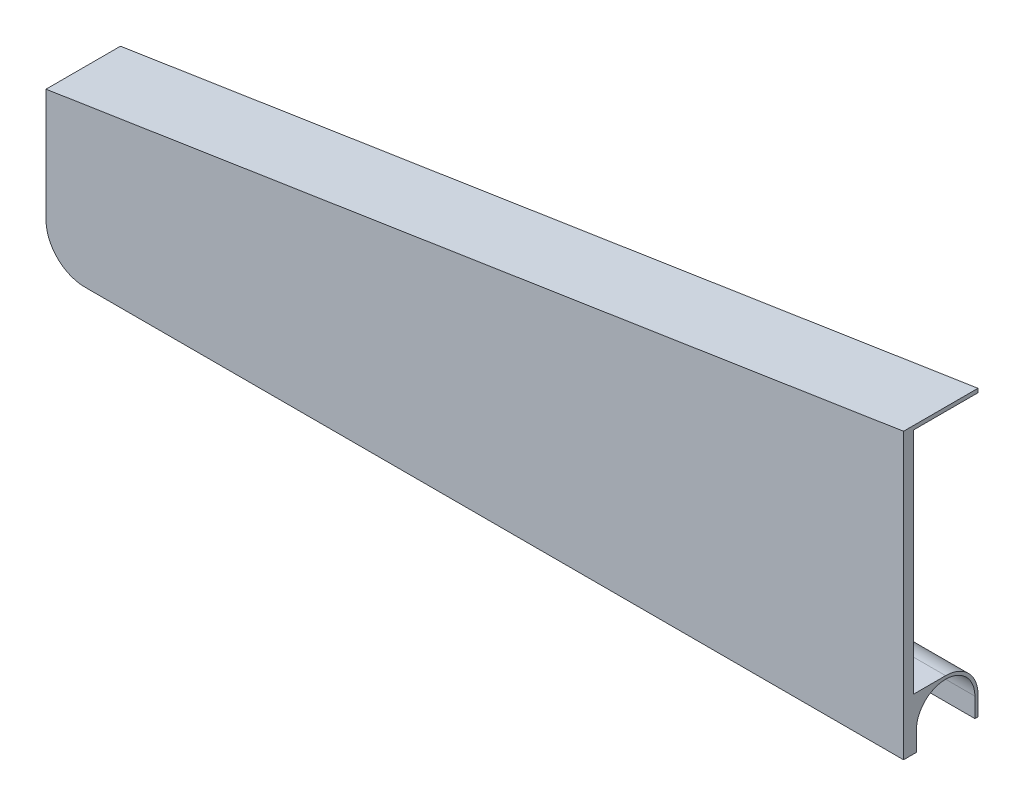
from build123d import *

# Parameters (mm, degrees)
BOSS_EXTRUDE1_DEPTH = 6.35
BOSS_EXTRUDE2_DEPTH = 558.8
CUT_EXTRUDE1_START  = -93.726
CUT_EXTRUDE1_DEPTH  = 93.726
CUT_EXTRUDE2_DEPTH  = 93.726
BOSS_EXTRUDE3_DEPTH = 42.164


with BuildPart() as part:
    # Sketch1 → Boss-Extrude1 (new body)
    with BuildSketch(Plane.XY):
        with BuildLine():
            Line((-508.085110878, -46.817945662), (-508.085110878, -168.737945662))
            Line((-508.085110878, -168.737945662), (-508.085110878, -181.437945662))
            ThreePointArc((-508.085110878, -181.437945662), (-500.64562312, -199.398457904), (-482.685110878, -206.837945662))
            Line((-482.685110878, -206.837945662), (50.714889122, -206.837945662))
            Line((50.714889122, -206.837945662), (50.714889122, -21.417945662))
            Line((50.714889122, -21.417945662), (-482.685110878, -21.417945662))
            ThreePointArc((-482.685110878, -21.417945662), (-500.64562312, -28.85743342), (-508.085110878, -46.817945662))
        make_face()
    extrude(amount=BOSS_EXTRUDE1_DEPTH)

    # Sketch2 → Boss-Extrude2 (add, through all)
    with BuildSketch(Plane(origin=(50.714889122, 0, 0), x_dir=(0, 0, -1), z_dir=(1, 0, 0))):
        with BuildLine():
            Line((0, -173.055945662), (0, -206.837945662))
            Line((0, -206.837945662), (2.032, -206.837945662))
            Line((2.032, -206.837945662), (2.032, -194.137945662))
            ThreePointArc((2.032, -194.137945662), (21.082, -175.087945662), (40.132, -194.137945662))
            Line((40.132, -194.137945662), (40.132, -206.837945662))
            Line((40.132, -206.837945662), (42.164, -206.837945662))
            Line((42.164, -206.837945662), (42.164, -194.137945662))
            ThreePointArc((42.164, -194.137945662), (35.989225161, -179.230720501), (21.082, -173.055945662))
            Line((21.082, -173.055945662), (0, -173.055945662))
        make_face()
    extrude(amount=-BOSS_EXTRUDE2_DEPTH)

    # Sketch3 → Cut-Extrude1 (cut)
    with BuildSketch(Plane.XY.offset(CUT_EXTRUDE1_START)):
        with BuildLine():
            Line((-508.085110878, -206.837945662), (-482.685110878, -206.837945662))
            ThreePointArc((-482.685110878, -206.837945662), (-500.64562312, -199.398457904), (-508.085110878, -181.437945662))
            Line((-508.085110878, -181.437945662), (-508.085110878, -206.837945662))
        make_face()
    extrude(amount=CUT_EXTRUDE1_DEPTH, mode=Mode.SUBTRACT)

    # Sketch4 → Cut-Extrude2 (cut)
    with BuildSketch(Plane(origin=(0, 0, 0), x_dir=(-1, 0, 0), z_dir=(0, 0, -1))):
        with BuildLine():
            Line((482.685110878, -21.417945662), (-50.714889122, -21.417945662))
            Line((-50.714889122, -21.417945662), (508.085110878, -107.777945662))
            Line((508.085110878, -107.777945662), (508.085110878, -46.817945662))
            ThreePointArc((508.085110878, -46.817945662), (500.64562312, -28.85743342), (482.685110878, -21.417945662))
        make_face()
    extrude(amount=-CUT_EXTRUDE2_DEPTH, mode=Mode.SUBTRACT)

    # Sketch5 → Boss-Extrude3 (add, through all)
    with BuildSketch(Plane(origin=(0, 0, 0), x_dir=(-1, 0, 0), z_dir=(0, 0, -1))):
        Polygon((-50.714889122, -21.417945662), (508.085110878, -107.777945662), (508.085110878, -110.317945662), (-50.714889122, -23.957945662), align=None)
    extrude(amount=BOSS_EXTRUDE3_DEPTH)


solid = part.part
